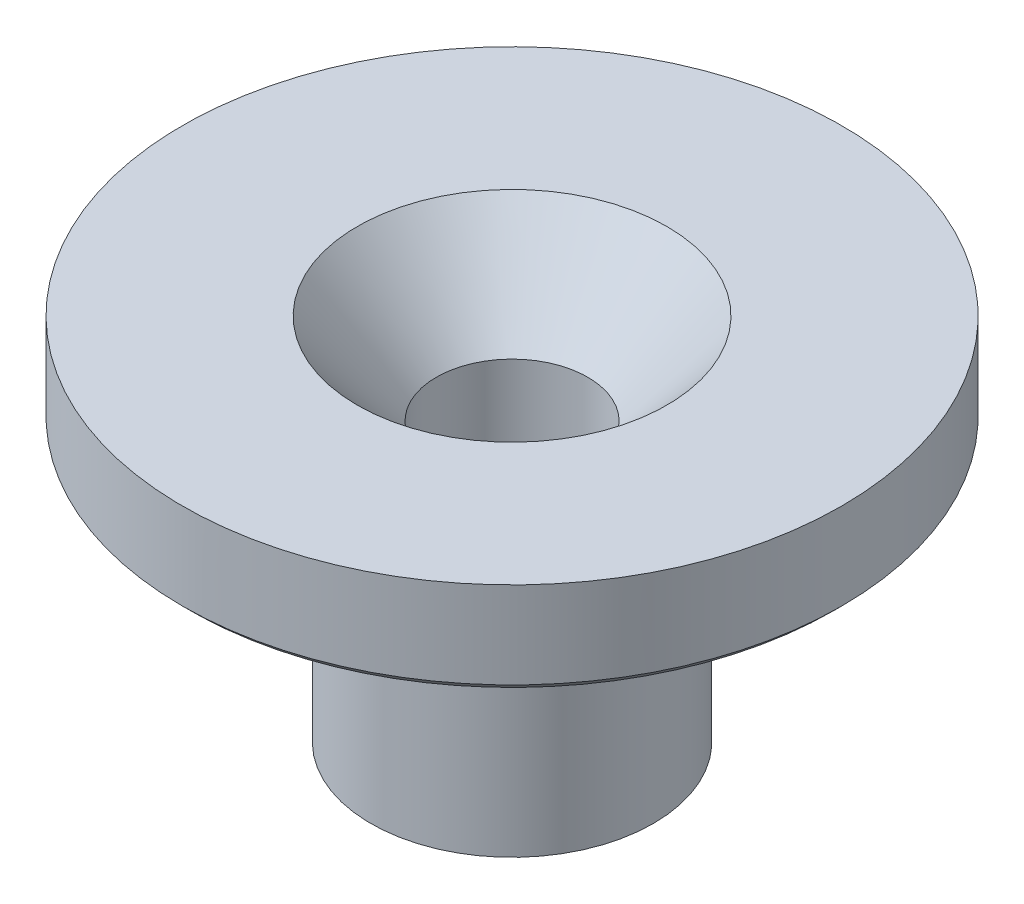
from build123d import *

# Parameters (mm, degrees)
CSK_FOR_10_FLAT_HEAD_SOCKET_CAP_SCREW1_D           = 5.1054
CSK_FOR_10_FLAT_HEAD_SOCKET_CAP_SCREW1_CSINK_D     = 10.4394
CSK_FOR_10_FLAT_HEAD_SOCKET_CAP_SCREW1_CSINK_ANGLE = 82
CHAMFER1_SIZE                                      = 0.254


with BuildPart() as part:
    # Sketch2 → Revolve1 (revolve)
    with BuildSketch(Plane.XY, mode=Mode.PRIVATE) as revolve1_sk:
        Polygon((0, 10.140493615), (-11.1125, 10.140493615), (-11.1125, 6.965493615), (-4.7625, 6.965493615), (-4.7625, -2.305506385), (0, -2.305506385), align=None)
    revolve(revolve1_sk.sketch.rotate(Axis((0, -2.305506385, 0), (0, 1, 0)), 180), axis=Axis((0, -2.305506385, 0), (0, 1, 0)))

    # CSK for #10 Flat Head Socket Cap Screw1 (through all)
    with Locations(Plane(origin=(0, 10.140493615, 0), x_dir=(1, 0, 0), z_dir=(0, 1, 0))):
        with Locations((0, 0)):
            CounterSinkHole(CSK_FOR_10_FLAT_HEAD_SOCKET_CAP_SCREW1_D / 2, CSK_FOR_10_FLAT_HEAD_SOCKET_CAP_SCREW1_CSINK_D / 2, counter_sink_angle=CSK_FOR_10_FLAT_HEAD_SOCKET_CAP_SCREW1_CSINK_ANGLE)

    # Chamfer1
    chamfer1_edges = [part.edges().sort_by_distance(p)[0] for p in [
        (-11.1125, 6.965493615, 0),
    ]]
    chamfer(chamfer1_edges, length=CHAMFER1_SIZE)


solid = part.part
